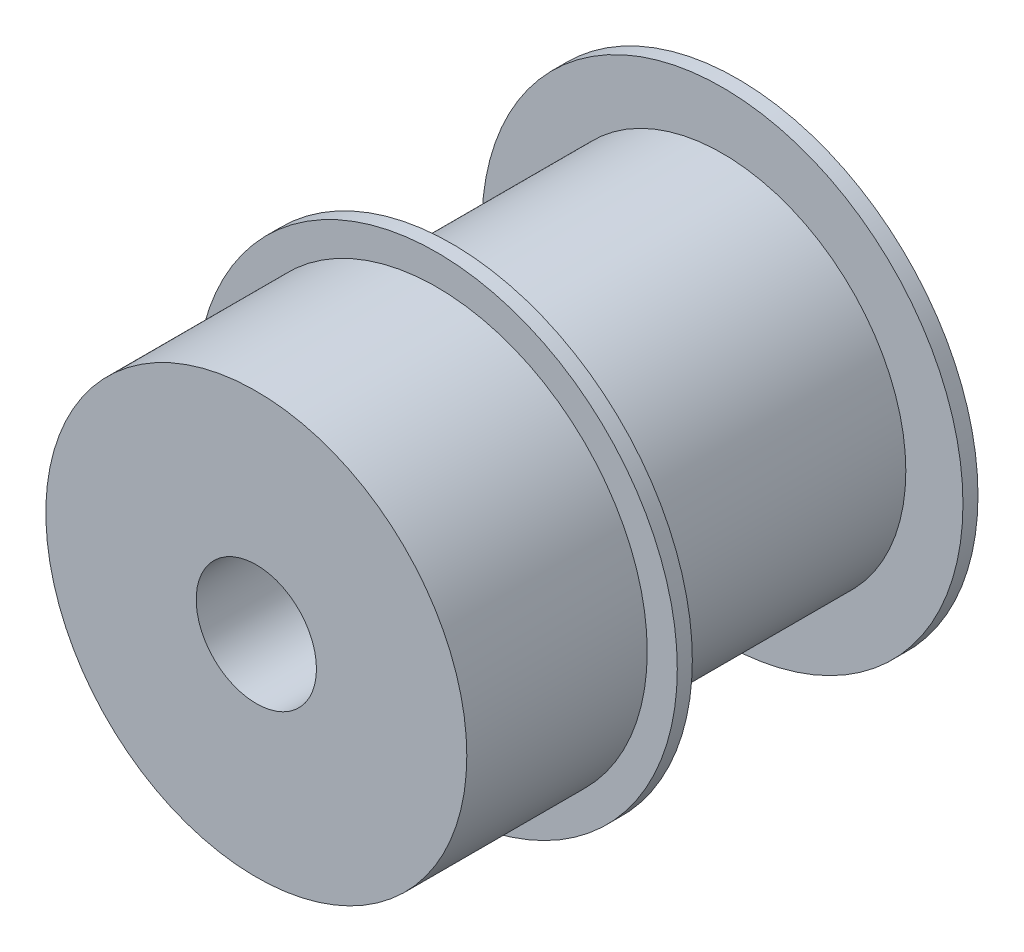
from build123d import *

# Parameters (mm, degrees)
ESQUISSE1_R      = 8
EXTRUSION1_DEPTH = 0.5
ESQUISSE2_R      = 6.1
EXTRUSION2_DEPTH = 9
ESQUISSE3_R      = 8
EXTRUSION3_DEPTH = 0.5
ESQUISSE4_R      = 7
EXTRUSION4_DEPTH = 6
ESQUISSE5_R      = 2
EXTRUSION5_DEPTH = 20.595917942


with BuildPart() as part:
    # Esquisse1 → Extrusion1 (new body)
    with BuildSketch(Plane.XY):
        Circle(ESQUISSE1_R)
    extrude(amount=EXTRUSION1_DEPTH)

    # Esquisse2 → Extrusion2 (add)
    with BuildSketch(Plane.XY.offset(0.5)):
        Circle(ESQUISSE2_R)
    extrude(amount=EXTRUSION2_DEPTH)

    # Esquisse3 → Extrusion3 (add)
    with BuildSketch(Plane.XY.offset(9.5)):
        Circle(ESQUISSE3_R)
    extrude(amount=EXTRUSION3_DEPTH)

    # Esquisse4 → Extrusion4 (add)
    with BuildSketch(Plane.XY.offset(10)):
        Circle(ESQUISSE4_R)
    extrude(amount=EXTRUSION4_DEPTH)

    # Esquisse5 → Extrusion5 (cut, through all)
    with BuildSketch(Plane.XY.offset(16)):
        Circle(ESQUISSE5_R)
    extrude(amount=-EXTRUSION5_DEPTH, mode=Mode.SUBTRACT)


solid = part.part
